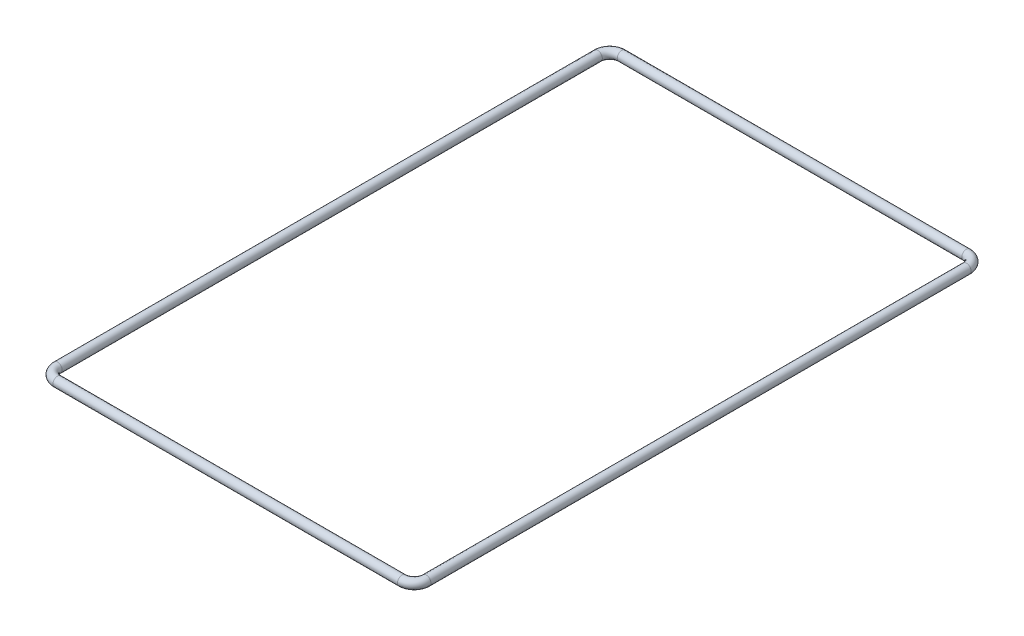
from build123d import *

# Parameters (mm, degrees)
SWEEP1_PROFILE_R = 2.5


with BuildPart() as part:
    # Sweep1: sweep along a path in Sketch1
    with BuildLine(Plane(origin=(0, 0, 0), x_dir=(1, 0, 0), z_dir=(0, 1, 0))) as sweep1_path:
        Line((-96.132982369, 157.069933949), (88.867017631, 157.069933949))
        ThreePointArc((88.867017631, 157.069933949), (93.463211709, 155.166128026), (95.367017631, 150.569933949))
        Line((95.367017631, 150.569933949), (95.367017631, -139.430066051))
        ThreePointArc((95.367017631, -139.430066051), (93.463211709, -144.026260129), (88.867017631, -145.930066051))
        Line((88.867017631, -145.930066051), (-96.132982369, -145.930066051))
        ThreePointArc((-96.132982369, -145.930066051), (-100.729176446, -144.026260129), (-102.632982369, -139.430066051))
        Line((-102.632982369, -139.430066051), (-102.632982369, 150.569933949))
        ThreePointArc((-102.632982369, 150.569933949), (-100.729176446, 155.166128026), (-96.132982369, 157.069933949))
    # Sweep1 profile (on start of the path) → Sweep1 (sweep)
    with BuildSketch(Plane(origin=(-96.132982369, 0, -157.069933949), x_dir=(0, 0, 1), z_dir=(1, 0, 0))):
        Circle(SWEEP1_PROFILE_R)
    sweep(path=sweep1_path.line)


solid = part.part
